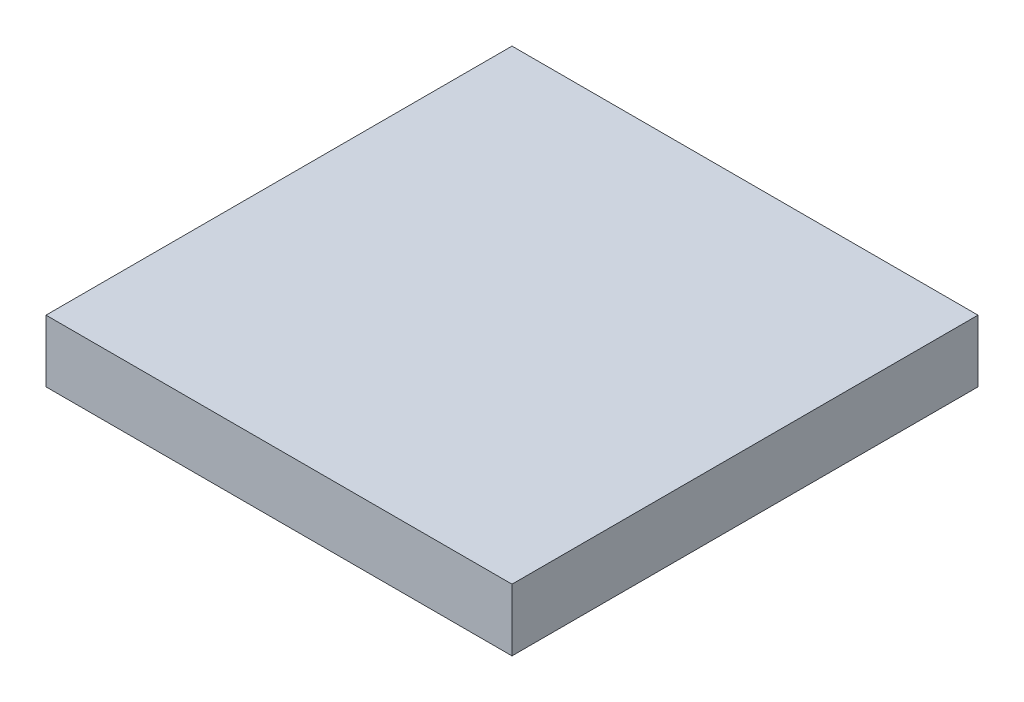
from build123d import *

# Parameters (mm, degrees)
SKETCH3_R            = 76.2
BOSS_EXTRUDE1_DEPTH  = 12.7
SKETCH6_R            = 69.85
CUT_EXTRUDE3_DEPTH   = 2.54
BOSS_EXTRUDE4_START  = 2.54
SKETCH8_R            = 10.16
BOSS_EXTRUDE4_DEPTH  = 2.54
SKETCH9_R            = 10.16
BOSS_EXTRUDE5_DEPTH  = 2.54
BOSS_EXTRUDE6_DEPTH  = 12.7
BOSS_EXTRUDE7_DEPTH  = 3.81
SKETCH12_R           = 19.05
CUT_EXTRUDE4_DEPTH   = 2.54
CIRPATTERN3_COUNT    = 4
BOSS_EXTRUDE8_DEPTH  = 2.54
SKETCH15_R           = 5.715
BOSS_EXTRUDE9_DEPTH  = 12.7
SKETCH16_W           = 381
SKETCH16_H           = 381
BOSS_EXTRUDE10_DEPTH = 50.8


with BuildPart() as part:
    # Sketch3 → Boss-Extrude1 (new body)
    with BuildSketch(Plane(origin=(0, 0, 0), x_dir=(1, 0, 0), z_dir=(0, 1, 0))):
        with Locations(Location((0, 0, 0), (0, 0, 270))):
            Circle(SKETCH3_R)
    extrude(amount=BOSS_EXTRUDE1_DEPTH)

    # Sketch6 → Cut-Extrude3 (cut)
    with BuildSketch(Plane(origin=(0, 12.7, 0), x_dir=(1, 0, 0), z_dir=(0, 1, 0))):
        with Locations(Location((0, 0, 0), (0, 0, 270))):
            Circle(SKETCH6_R)
    cut_extrude3 = extrude(amount=-CUT_EXTRUDE3_DEPTH, mode=Mode.SUBTRACT)

    # Sketch8 → Boss-Extrude4 (add)
    with BuildSketch(Plane(origin=(0, 10.16, 0), x_dir=(1, 0, 0), z_dir=(0, 1, 0)).offset(BOSS_EXTRUDE4_START)):
        with BuildLine():
            ThreePointArc((0, 0), (34.925, 34.925), (0, 69.85))
            ThreePointArc((0, 69.85), (-69.85, 0), (0, -69.85))
            ThreePointArc((0, -69.85), (-34.925, -34.925), (0, 0))
        make_face()
        with Locations(Location((0, 34.925, 0), (0, 0, 270))):
            Circle(SKETCH8_R, mode=Mode.SUBTRACT)
    boss_extrude4 = extrude(amount=-BOSS_EXTRUDE4_DEPTH)

    # Sketch9 → Boss-Extrude5 (add)
    with BuildSketch(Plane(origin=(0, 10.16, 0), x_dir=(1, 0, 0), z_dir=(0, 1, 0))):
        with Locations(Location((0, -34.925, 0), (0, 0, 270))):
            Circle(SKETCH9_R)
    boss_extrude5 = extrude(amount=BOSS_EXTRUDE5_DEPTH)

    # Mirror1: Cut-Extrude3, Boss-Extrude4, Boss-Extrude5 across plane
    add(cut_extrude3.mirror(Plane.ZX.offset(6.35)), mode=Mode.SUBTRACT)
    add(boss_extrude4.mirror(Plane.ZX.offset(6.35)))
    add(boss_extrude5.mirror(Plane.ZX.offset(6.35)))


with BuildPart() as body_2:
    # Sketch10 → Boss-Extrude6 (new body)
    with BuildSketch(Plane(origin=(0, 12.7, 0), x_dir=(1, 0, 0), z_dir=(0, 1, 0))):
        Polygon((0, 82.55), (31.75, 120.65), (0, 158.75), (-31.75, 120.65), align=None)
    extrude(amount=-BOSS_EXTRUDE6_DEPTH)

    # Sketch12 → Cut-Extrude4 (cut)
    with BuildSketch(Plane(origin=(0, 12.7, 0), x_dir=(1, 0, 0), z_dir=(0, 1, 0))):
        with Locations(Location((0, 120.65, 0), (0, 0, 270))):
            Circle(SKETCH12_R)
    cut_extrude4 = extrude(amount=-CUT_EXTRUDE4_DEPTH, mode=Mode.SUBTRACT)

    # Mirror2: Cut-Extrude4 across plane
    add(cut_extrude4.mirror(Plane.ZX.offset(6.35)), mode=Mode.SUBTRACT)


with BuildPart() as body_3:
    # Sketch11 → Boss-Extrude7 (new, symmetric)
    with BuildSketch(Plane(origin=(0, 6.35, 0), x_dir=(1, 0, 0), z_dir=(0, 1, 0))):
        with BuildLine():
            Line((0, 82.55), (-5.08, 88.646))
            Line((-5.08, 88.646), (-5.08, 76.030478099))
            ThreePointArc((-5.08, 76.030478099), (0, 76.2), (5.08, 76.030478099))
            Line((5.08, 76.030478099), (5.08, 88.646))
            Line((5.08, 88.646), (0, 82.55))
        make_face()
    extrude(amount=BOSS_EXTRUDE7_DEPTH, both=True)


with BuildPart() as cirpattern3_1:
    # CirPattern3: pattern copy
    add(body_2.part.rotate(Axis((0, 0, 0), (0, 1, 0)), 1 * 360 / CIRPATTERN3_COUNT))


with BuildPart() as cirpattern3_2:
    # CirPattern3: pattern copy
    add(body_2.part.rotate(Axis((0, 0, 0), (0, 1, 0)), 2 * 360 / CIRPATTERN3_COUNT))


with BuildPart() as cirpattern3_3:
    # CirPattern3: pattern copy
    add(body_2.part.rotate(Axis((0, 0, 0), (0, 1, 0)), 3 * 360 / CIRPATTERN3_COUNT))


with BuildPart() as cirpattern3_4:
    # CirPattern3: pattern copy
    add(body_3.part.rotate(Axis((0, 0, 0), (0, 1, 0)), 1 * 360 / CIRPATTERN3_COUNT))


with BuildPart() as cirpattern3_5:
    # CirPattern3: pattern copy
    add(body_3.part.rotate(Axis((0, 0, 0), (0, 1, 0)), 2 * 360 / CIRPATTERN3_COUNT))


with BuildPart() as cirpattern3_6:
    # CirPattern3: pattern copy
    add(body_3.part.rotate(Axis((0, 0, 0), (0, 1, 0)), 3 * 360 / CIRPATTERN3_COUNT))


with BuildPart() as body_2_1:
    add(body_2.part)

    # Combine2: union body 3, CirPattern3_1, CirPattern3_4, CirPattern3_2, CirPattern3_5, CirPattern3_3, CirPattern3_6, part
    add(body_3.part)
    add(cirpattern3_1.part)
    add(cirpattern3_4.part)
    add(cirpattern3_2.part)
    add(cirpattern3_5.part)
    add(cirpattern3_3.part)
    add(cirpattern3_6.part)
    add(part.part)

    # Sketch13 → Boss-Extrude8 (add)
    with BuildSketch(Plane(origin=(0, 10.16, 0), x_dir=(1, 0, 0), z_dir=(0, 1, 0))):
        with BuildLine():
            Line((1.892967954, 131.44027369), (3.84927803, 131.44027369))
            Line((3.84927803, 131.44027369), (3.84927803, 122.820282418))
            add(Edge.make_bspline(
                [(3.84927803, 122.820282418), (4.446188849, 123.125794078), (5.630984425, 123.732197667), (7.357560834, 124.705081068), (9.026272835, 125.718270253), (10.099049451, 126.437248903), (10.631407687, 126.79403726)],
                knots=[0, 0, 0, 0, 1.022820579, 2.030174792, 3.022487387, 4, 4, 4, 4], degree=3))
            Line((10.631407687, 126.79403726), (11.919057092, 124.898861874))
            add(Edge.make_bspline(
                [(11.919057092, 124.898861874), (11.66851215, 124.749232636), (11.146568272, 124.43751984), (10.322090954, 123.962039094), (9.424232055, 123.46365093), (8.448788257, 122.944490011), (7.406386358, 122.394209512), (6.285914539, 121.823994669), (5.092525982, 121.230398084), (4.27102365, 120.826690391), (3.84927803, 120.619433583)],
                knots=[0, 0, 0, 0, 0.766497465, 1.596793999, 2.49976746, 3.463618194, 4.499116271, 5.595778448, 6.765712684, 8, 8, 8, 8], degree=3))
            Line((3.84927803, 120.619433583), (3.84927803, 111.177944917))
            add(Edge.make_bspline(
                [(3.84927803, 111.177944917), (3.854585896, 111.041186607), (3.864645024, 110.782011036), (3.954448138, 110.417918394), (4.116618059, 110.111653808), (4.334139263, 109.853413571), (4.622480552, 109.660741595), (4.969832127, 109.528290514), (5.374872715, 109.443273655), (5.666286439, 109.435767241), (5.820871778, 109.431785337)],
                knots=[0, 0, 0, 0, 1.088042577, 2.061988458, 2.955545677, 3.825547268, 4.72277933, 5.683116304, 6.770969853, 8, 8, 8, 8], degree=3))
            Line((5.820871778, 109.431785337), (7.658733392, 109.431785337))
            add(Edge.make_bspline(
                [(7.658733392, 109.431785337), (7.808178262, 109.436239942), (8.091652631, 109.444689654), (8.491608331, 109.525874512), (8.843637241, 109.65801397), (9.142118731, 109.852151027), (9.390450325, 110.098070216), (9.579689584, 110.40205978), (9.7187208, 110.757133978), (9.763613802, 111.01628585), (9.786984783, 111.15119849)],
                knots=[0, 0, 0, 0, 1.176296188, 2.231256381, 3.200380393, 4.12176926, 5.015919466, 5.931881419, 6.923352023, 8, 8, 8, 8], degree=3))
            add(Edge.make_bspline(
                [(9.786984783, 111.15119849), (9.80637617, 111.288712875), (9.84656908, 111.57374165), (9.903236017, 112.017070014), (9.961467251, 112.490630195), (10.014671261, 112.995083702), (10.063055147, 113.528997585), (10.113118827, 114.093186102), (10.163490934, 114.686561669), (10.192479119, 115.09307545), (10.207285776, 115.300715565)],
                knots=[0, 0, 0, 0, 0.798946526, 1.655992206, 2.571203282, 3.543834044, 4.574071652, 5.655391179, 6.802414908, 8, 8, 8, 8], degree=3))
            add(Edge.make_bspline(
                [(10.207285776, 115.300715565), (10.579560172, 115.153113474), (11.308034071, 114.864282785), (12.046868939, 114.603104664), (12.408134611, 114.475397251)],
                knots=[0, 0, 0, 0, 1.022066534, 2, 2, 2, 2], degree=3))
            add(Edge.make_bspline(
                [(12.408134611, 114.475397251), (12.36621782, 114.08804749), (12.285616853, 113.343220323), (12.147236759, 112.272033478), (12.004695782, 111.289408438), (11.895010521, 110.665709774), (11.84263873, 110.367910276)],
                knots=[0, 0, 0, 0, 1.127321304, 2.167703761, 3.125127353, 4, 4, 4, 4], degree=3))
            add(Edge.make_bspline(
                [(11.84263873, 110.367910276), (11.820166361, 110.250350716), (11.776565591, 110.022262285), (11.683884216, 109.693634704), (11.569496948, 109.388450159), (11.435728304, 109.104448242), (11.282824213, 108.842287224), (11.106623455, 108.603263746), (10.905313618, 108.391162715), (10.692985408, 108.191794429), (10.451256704, 108.024721516), (10.193390019, 107.873980501), (9.910784154, 107.754116898), (9.6122375, 107.647393267), (9.28967502, 107.57488161), (8.948163384, 107.515937369), (8.585356458, 107.481826105), (8.336377294, 107.477625302), (8.208945601, 107.475475261)],
                knots=[0, 0, 0, 0, 1.116226934, 2.165697541, 3.180909139, 4.153577859, 5.090988615, 6.008303141, 6.916335999, 7.816325753, 8.719682016, 9.651124589, 10.598200016, 11.578963607, 12.60496533, 13.677391352, 14.811250122, 16, 16, 16, 16], degree=3))
            Line((8.208945601, 107.475475261), (5.423496294, 107.475475261))
            add(Edge.make_bspline(
                [(5.423496294, 107.475475261), (5.280784955, 107.478988505), (5.00376197, 107.485808209), (4.602157918, 107.521702285), (4.228953745, 107.590919412), (3.884432406, 107.687249886), (3.563487403, 107.803404366), (3.272409822, 107.954490134), (3.005179557, 108.128902006), (2.772616094, 108.338546039), (2.563098995, 108.568965166), (2.383371043, 108.827555385), (2.227629434, 109.112127599), (2.109637759, 109.427552541), (2.006652935, 109.765992606), (1.940265268, 110.132610356), (1.90291159, 110.526329797), (1.896360409, 110.797041869), (1.892967954, 110.937227075)],
                knots=[0, 0, 0, 0, 1.207724317, 2.344364487, 3.407518916, 4.414116094, 5.368906001, 6.289451299, 7.183111677, 8.061039675, 8.930928054, 9.812881299, 10.719379409, 11.66794594, 12.656792795, 13.709353562, 14.813814466, 16, 16, 16, 16], degree=3))
            Line((1.892967954, 110.937227075), (1.892967954, 131.44027369))
        make_face()
        with BuildLine():
            add(Edge.make_bspline(
                [(-13.512973893, 111.143556653), (-13.222470201, 111.250229995), (-12.626634589, 111.469021623), (-11.714628015, 111.810770234), (-10.766155115, 112.184517473), (-9.77719343, 112.576559449), (-8.748783153, 112.994786718), (-7.679750995, 113.431370991), (-6.5746724, 113.900416472), (-5.825222553, 114.220522845), (-5.44319483, 114.383695217)],
                knots=[0, 0, 0, 0, 0.853992928, 1.751576359, 2.687507784, 3.667141357, 4.687247669, 5.751116521, 6.853644661, 8, 8, 8, 8], degree=3))
            Line((-5.44319483, 114.383695217), (-5.44319483, 122.392339589))
            Line((-5.44319483, 122.392339589), (-13.023896374, 122.392339589))
            Line((-13.023896374, 122.392339589), (-13.023896374, 124.348649665))
            Line((-13.023896374, 124.348649665), (-5.44319483, 124.348649665))
            Line((-5.44319483, 124.348649665), (-5.44319483, 131.44027369))
            Line((-5.44319483, 131.44027369), (-3.486884755, 131.44027369))
            Line((-3.486884755, 131.44027369), (-3.486884755, 106.741858983))
            Line((-3.486884755, 106.741858983), (-5.44319483, 106.741858983))
            Line((-5.44319483, 106.741858983), (-5.44319483, 112.182846381))
            add(Edge.make_bspline(
                [(-5.44319483, 112.182846381), (-5.663571597, 112.092508382), (-6.128618978, 111.901873722), (-6.860311246, 111.599712028), (-7.66281192, 111.273196412), (-8.532581621, 110.910635519), (-9.473908471, 110.524236073), (-10.482434038, 110.101665072), (-11.561942335, 109.655115337), (-12.304335935, 109.346561827), (-12.68765558, 109.187246578)],
                knots=[0, 0, 0, 0, 0.729160524, 1.538702097, 2.423536663, 3.381542013, 4.423533021, 5.538703759, 6.72916038, 8, 8, 8, 8], degree=3))
            Line((-12.68765558, 109.187246578), (-13.512973893, 111.143556653))
        make_face()
    boss_extrude8 = extrude(amount=BOSS_EXTRUDE8_DEPTH)

    # Sketch14 → Revolve1 (revolve)
    with BuildSketch(Plane.XY):
        with BuildLine():
            Line((0, 12.7), (17.78, 12.7))
            Line((17.78, 12.7), (17.78, 17.78))
            Line((17.78, 17.78), (15.24, 17.78))
            ThreePointArc((15.24, 17.78), (7.725108413, 15.879349519), (0, 15.24))
            Line((0, 15.24), (0, 12.7))
        make_face()
    revolve1 = revolve(axis=Axis((0, 12.7, 0), (0, 1, 0)))

    # Mirror3: Revolve1 across plane
    add(revolve1.mirror(Plane.ZX.offset(6.35)))

    # Mirror4: Boss-Extrude8 across plane
    add(boss_extrude8.mirror(Plane.ZX.offset(6.35)))

    # Sketch15 → Boss-Extrude9 (add)
    with BuildSketch(Plane(origin=(0, 12.7, 0), x_dir=(1, 0, 0), z_dir=(0, 1, 0))):
        Circle(SKETCH15_R)
    extrude(amount=-BOSS_EXTRUDE9_DEPTH)


with BuildPart() as body_2_2:
    # Sketch16 → Boss-Extrude10 (new body)
    with BuildSketch(Plane(origin=(0, 0, 0), x_dir=(1, 0, 0), z_dir=(0, 1, 0))):
        Rectangle(SKETCH16_W, SKETCH16_H)
    extrude(amount=BOSS_EXTRUDE10_DEPTH)


solid = Compound([body_2_1.part, body_2_2.part])
